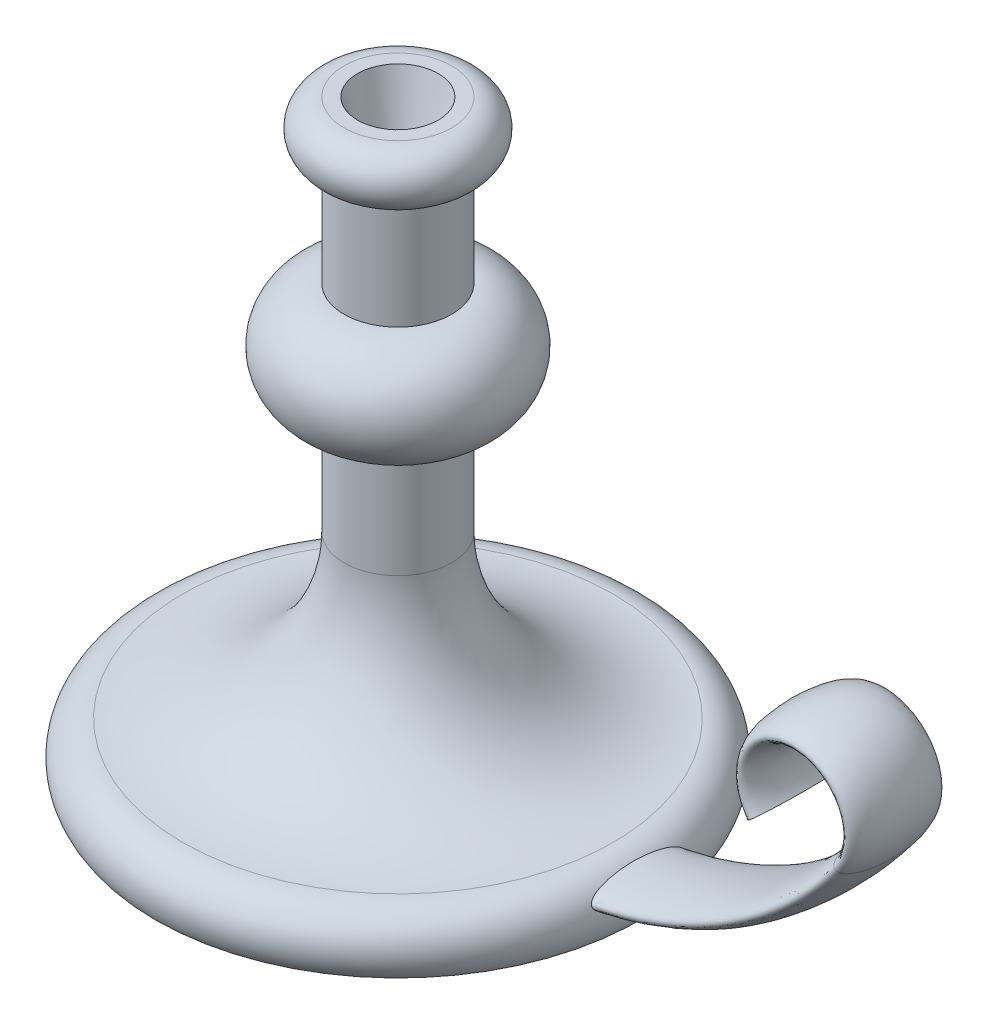
from build123d import *

# Parameters (mm, degrees)
SZKIC5_RX                  = 17.5
SZKIC5_RY                  = 5
SZKIC8_R                   = 15
WYTNIJ_WYCI_GNI_CIE1_DEPTH = 25
WYTNIJ_WYCI_GNI_CIE1_DRAFT = -15


with BuildPart() as part:
    # Szkic2 → Obrót1 (revolve)
    with BuildSketch(Plane.XY, mode=Mode.PRIVATE) as obr_t1_sk:
        with BuildLine():
            Line((0, 0), (0, 220))
            Line((0, 220), (20, 220))
            ThreePointArc((20, 220), (30, 210), (20, 200))
            Line((20, 200), (20, 160))
            ThreePointArc((20, 160), (40, 140), (20, 120))
            Line((20, 120), (20, 80))
            ThreePointArc((20, 80), (37.573593129, 37.573593129), (80, 20))
            ThreePointArc((80, 20), (91.180339887, 13.090169944), (90, 0))
            Line((90, 0), (0, 0))
        make_face()
    revolve(obr_t1_sk.sketch.rotate(Axis((0, 0, 0), (0, 1, 0)), 90), axis=Axis((0, 0, 0), (0, 1, 0)))

    # Wyciągnięcie po ścieżce1: sweep along a path in Szkic3
    with BuildLine(Plane.XY) as wyci_gni_cie_po_cie_ce1_path:
        Line((0, 10), (60, 10))
        ThreePointArc((60, 10), (127.082039325, 25.83592135), (180, 70))
        ThreePointArc((180, 70), (164, 102), (148, 70))
    # Szkic5 → Wyciągnięcie po ścieżce1 (sweep)
    with BuildSketch(Plane(origin=(0, 0, 0), x_dir=(0, 0, -1), z_dir=(1, 0, 0))):
        with Locations((0, 10)):
            Ellipse(SZKIC5_RX, SZKIC5_RY)
    sweep(path=wyci_gni_cie_po_cie_ce1_path.line)


with BuildPart() as wytnij_wyci_gni_cie1_tool:
    # Szkic8 → Wytnij-wyciągnięcie1 (with draft: the straight prism first)
    with BuildSketch(Plane(origin=(0, 220, 0), x_dir=(1, 0, 0), z_dir=(0, 1, 0))):
        Circle(SZKIC8_R)
    extrude(amount=-WYTNIJ_WYCI_GNI_CIE1_DEPTH)
    # Wytnij-wyciągnięcie1: the draft: its side faces are tilted about the plane it starts from
    wytnij_wyci_gni_cie1_sides = [wytnij_wyci_gni_cie1_tool.faces().sort_by_distance(p)[0] for p in [
        (-15, 207.5, 0),
    ]]
    draft(wytnij_wyci_gni_cie1_sides, Plane(origin=(0, 220, 0), x_dir=(1, 0, 0), z_dir=(0, 1, 0)), WYTNIJ_WYCI_GNI_CIE1_DRAFT)


with BuildPart() as part_1:
    add(part.part)

    # Wytnij-wyciągnięcie1: cut by wytnij_wyci_gni_cie1_tool
    add(wytnij_wyci_gni_cie1_tool.part, mode=Mode.SUBTRACT)


solid = part_1.part
